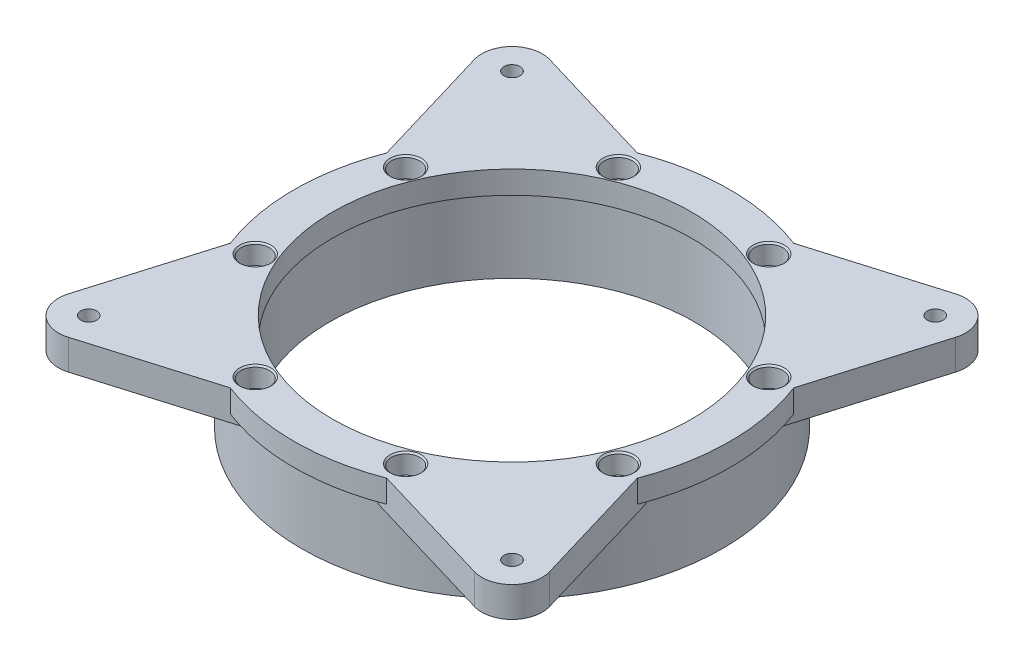
from build123d import *

# Parameters (mm, degrees)
SKETCH2_R                                     = 88.395010725
SKETCH2_R_2                                   = 76.6365
BOSS_EXTRUDE1_DEPTH                           = 40.64
BOSS_EXTRUDE2_START                           = -12.7
BOSS_EXTRUDE2_DEPTH                           = 12.7
CBORE_FOR_1_4_SOCKET_HEAD_CAP_SCREW1_AT_COUNT = 2
CBORE_FOR_1_4_SOCKET_HEAD_CAP_SCREW1_AT_PITCH = 177.8
CBORE_FOR_1_4_SOCKET_HEAD_CAP_SCREW1_2_COUNT  = 2
CBORE_FOR_1_4_SOCKET_HEAD_CAP_SCREW1_2_PITCH  = 251.44717139
CBORE_FOR_1_4_SOCKET_HEAD_CAP_SCREW1_3_COUNT  = 2
CBORE_FOR_1_4_SOCKET_HEAD_CAP_SCREW1_3_PITCH  = 177.8
SKETCH10_R                                    = 91.570010725
SKETCH10_R_2                                  = 75.3865
BOSS_EXTRUDE3_DEPTH                           = 9.525
CBORE_FOR_1_4_BUTTON_HEAD_CAP_SCREW1_AT_COUNT = 2
CBORE_FOR_1_4_BUTTON_HEAD_CAP_SCREW1_AT_PITCH = 63.181034683
CBORE_FOR_1_4_BUTTON_HEAD_CAP_SCREW1_2_COUNT  = 2
CBORE_FOR_1_4_BUTTON_HEAD_CAP_SCREW1_2_PITCH  = 116.743329574
CBORE_FOR_1_4_BUTTON_HEAD_CAP_SCREW1_3_COUNT  = 2
CBORE_FOR_1_4_BUTTON_HEAD_CAP_SCREW1_3_PITCH  = 152.532510818
CBORE_FOR_1_4_BUTTON_HEAD_CAP_SCREW1_4_COUNT  = 2
CBORE_FOR_1_4_BUTTON_HEAD_CAP_SCREW1_4_PITCH  = 165.1
CBORE_FOR_1_4_BUTTON_HEAD_CAP_SCREW1_5_COUNT  = 2
CBORE_FOR_1_4_BUTTON_HEAD_CAP_SCREW1_5_PITCH  = 152.532510818
CBORE_FOR_1_4_BUTTON_HEAD_CAP_SCREW1_6_COUNT  = 2
CBORE_FOR_1_4_BUTTON_HEAD_CAP_SCREW1_6_PITCH  = 116.743329574
CBORE_FOR_1_4_BUTTON_HEAD_CAP_SCREW1_7_COUNT  = 2
CBORE_FOR_1_4_BUTTON_HEAD_CAP_SCREW1_7_PITCH  = 63.181034683


with BuildPart() as part:
    # Sketch2 → Boss-Extrude1 (new body)
    with BuildSketch(Plane(origin=(0, 0, 0), x_dir=(1, 0, 0), z_dir=(0, 1, 0))):
        with Locations(Location((112.864370177, 65.400443246, 0), (0, 0, 270))):
            Circle(SKETCH2_R)
        with Locations(Location((112.864370177, 65.400443246, 0), (0, 0, 270))):
            Circle(SKETCH2_R_2, mode=Mode.SUBTRACT)
    extrude(amount=BOSS_EXTRUDE1_DEPTH)

    # Sketch7 → Boss-Extrude2 (add)
    with BuildSketch(Plane(origin=(0, 40.64, 0), x_dir=(1, 0, 0), z_dir=(0, 1, 0)).offset(BOSS_EXTRUDE2_START)):
        with BuildLine():
            Line((27.586360499, 166.473001979), (85.159974048, 149.341758199))
            ThreePointArc((85.159974048, 149.341758199), (50.359658671, 127.905154752), (28.923055224, 93.104839375))
            Line((28.923055224, 93.104839375), (11.791811444, 150.678452924))
            ThreePointArc((11.791811444, 150.678452924), (14.984114056, 163.280699367), (27.586360499, 166.473001979))
        make_face()
        with BuildLine():
            Line((198.142379855, 166.473001979), (140.568766306, 149.341758199))
            ThreePointArc((140.568766306, 149.341758199), (175.369081684, 127.905154752), (196.805685131, 93.104839375))
            Line((196.805685131, 93.104839375), (213.93692891, 150.678452924))
            ThreePointArc((213.93692891, 150.678452924), (210.744626298, 163.280699367), (198.142379855, 166.473001979))
        make_face()
        with BuildLine():
            Line((213.93692891, -19.877566432), (196.805685131, 37.696047117))
            ThreePointArc((196.805685131, 37.696047117), (175.369081684, 2.89573174), (140.568766306, -18.540871708))
            Line((140.568766306, -18.540871708), (198.142379855, -35.672115487))
            ThreePointArc((198.142379855, -35.672115487), (210.744626298, -32.479812875), (213.93692891, -19.877566432))
        make_face()
        with BuildLine():
            Line((27.586360499, -35.672115487), (85.159974048, -18.540871708))
            ThreePointArc((85.159974048, -18.540871708), (50.359658671, 2.89573174), (28.923055224, 37.696047117))
            Line((28.923055224, 37.696047117), (11.791811444, -19.877566432))
            ThreePointArc((11.791811444, -19.877566432), (14.984114056, -32.479812875), (27.586360499, -35.672115487))
        make_face()
    extrude(amount=BOSS_EXTRUDE2_DEPTH)

    # Sketch9 → CBORE for 1/4 Socket Head Cap Screw1 (revolve, cut)
    with BuildSketch(Plane(origin=(23.964370177, 27.94, 23.499556754), x_dir=(0, 0, -1), z_dir=(1, 0, 0))):
        Polygon((0, 0), (0, 12.7), (3.3782, 12.7), (3.3782, 6.35), (5.55625, 6.35), (5.55625, 0.635), (6.19125, 0), align=None)
    cbore_for_1_4_socket_head_cap_screw1 = revolve(axis=Axis((23.964370177, 21.59, 23.499556754), (0, 1, 0)), mode=Mode.SUBTRACT)

    # CBORE for 1/4 Socket Head Cap Screw1 at: CBORE for 1/4 Socket Head Cap Screw1 ×2
    with Locations(*[(i * CBORE_FOR_1_4_SOCKET_HEAD_CAP_SCREW1_AT_PITCH, 0, 0) for i in range(1, CBORE_FOR_1_4_SOCKET_HEAD_CAP_SCREW1_AT_COUNT)]):
        add(cbore_for_1_4_socket_head_cap_screw1, mode=Mode.SUBTRACT)

    # CBORE for 1_4 Socket Head Cap Screw1 2: CBORE for 1/4 Socket Head Cap Screw1 ×2
    with Locations(*[Vector(0.7071067811865512, 0, -0.7071067811865438) * (i * CBORE_FOR_1_4_SOCKET_HEAD_CAP_SCREW1_2_PITCH) for i in range(1, CBORE_FOR_1_4_SOCKET_HEAD_CAP_SCREW1_2_COUNT)]):
        add(cbore_for_1_4_socket_head_cap_screw1, mode=Mode.SUBTRACT)

    # CBORE for 1_4 Socket Head Cap Screw1 3: CBORE for 1/4 Socket Head Cap Screw1 ×2
    with Locations(*[(0, 0, -i * CBORE_FOR_1_4_SOCKET_HEAD_CAP_SCREW1_3_PITCH) for i in range(1, CBORE_FOR_1_4_SOCKET_HEAD_CAP_SCREW1_3_COUNT)]):
        add(cbore_for_1_4_socket_head_cap_screw1, mode=Mode.SUBTRACT)

    # Sketch10 → Boss-Extrude3 (add)
    with BuildSketch(Plane(origin=(0, 40.64, 0), x_dir=(1, 0, 0), z_dir=(0, 1, 0))):
        with Locations((112.864370177, 65.400443246)):
            Circle(SKETCH10_R)
        with Locations(Location((112.864370177, 65.400443246, 0), (0, 0, 270))):
            Circle(SKETCH10_R_2, mode=Mode.SUBTRACT)
    extrude(amount=-BOSS_EXTRUDE3_DEPTH)

    # Sketch12 → CBORE for 1/4 Button Head Cap Screw1 (revolve, cut)
    with BuildSketch(Plane(origin=(36.598114768, 40.64, -33.809925904), x_dir=(0, 0, 1), z_dir=(1, 0, 0))):
        Polygon((0, 0), (0, 40.64), (3.3782, 40.64), (3.3782, 8.35279), (5.95376, 8.35279), (5.95376, 0.635), (6.58876, 0), align=None)
    cbore_for_1_4_button_head_cap_screw1 = revolve(axis=Axis((36.598114768, 46.99, -33.809925904), (0, -1, 0)), mode=Mode.SUBTRACT)

    # CBORE for 1/4 Button Head Cap Screw1 at: CBORE for 1/4 Button Head Cap Screw1 ×2
    with Locations(*[(0, 0, -i * CBORE_FOR_1_4_BUTTON_HEAD_CAP_SCREW1_AT_PITCH) for i in range(1, CBORE_FOR_1_4_BUTTON_HEAD_CAP_SCREW1_AT_COUNT)]):
        add(cbore_for_1_4_button_head_cap_screw1, mode=Mode.SUBTRACT)

    # CBORE for 1_4 Button Head Cap Screw1 2: CBORE for 1/4 Button Head Cap Screw1 ×2
    with Locations(*[Vector(0.3826834323650937, 0, -0.9238795325112852) * (i * CBORE_FOR_1_4_BUTTON_HEAD_CAP_SCREW1_2_PITCH) for i in range(1, CBORE_FOR_1_4_BUTTON_HEAD_CAP_SCREW1_2_COUNT)]):
        add(cbore_for_1_4_button_head_cap_screw1, mode=Mode.SUBTRACT)

    # CBORE for 1_4 Button Head Cap Screw1 3: CBORE for 1/4 Button Head Cap Screw1 ×2
    with Locations(*[Vector(0.7071067811865462, 0, -0.7071067811865489) * (i * CBORE_FOR_1_4_BUTTON_HEAD_CAP_SCREW1_3_PITCH) for i in range(1, CBORE_FOR_1_4_BUTTON_HEAD_CAP_SCREW1_3_COUNT)]):
        add(cbore_for_1_4_button_head_cap_screw1, mode=Mode.SUBTRACT)

    # CBORE for 1_4 Button Head Cap Screw1 4: CBORE for 1/4 Button Head Cap Screw1 ×2
    with Locations(*[Vector(0.9238795325112864, 0, -0.38268343236509067) * (i * CBORE_FOR_1_4_BUTTON_HEAD_CAP_SCREW1_4_PITCH) for i in range(1, CBORE_FOR_1_4_BUTTON_HEAD_CAP_SCREW1_4_COUNT)]):
        add(cbore_for_1_4_button_head_cap_screw1, mode=Mode.SUBTRACT)

    # CBORE for 1_4 Button Head Cap Screw1 5: CBORE for 1/4 Button Head Cap Screw1 ×2
    with Locations(*[(i * CBORE_FOR_1_4_BUTTON_HEAD_CAP_SCREW1_5_PITCH, 0, 0) for i in range(1, CBORE_FOR_1_4_BUTTON_HEAD_CAP_SCREW1_5_COUNT)]):
        add(cbore_for_1_4_button_head_cap_screw1, mode=Mode.SUBTRACT)

    # CBORE for 1_4 Button Head Cap Screw1 6: CBORE for 1/4 Button Head Cap Screw1 ×2
    with Locations(*[Vector(0.9238795325112864, 0, 0.3826834323650908) * (i * CBORE_FOR_1_4_BUTTON_HEAD_CAP_SCREW1_6_PITCH) for i in range(1, CBORE_FOR_1_4_BUTTON_HEAD_CAP_SCREW1_6_COUNT)]):
        add(cbore_for_1_4_button_head_cap_screw1, mode=Mode.SUBTRACT)

    # CBORE for 1_4 Button Head Cap Screw1 7: CBORE for 1/4 Button Head Cap Screw1 ×2
    with Locations(*[Vector(0.7071067811865459, 0, 0.7071067811865491) * (i * CBORE_FOR_1_4_BUTTON_HEAD_CAP_SCREW1_7_PITCH) for i in range(1, CBORE_FOR_1_4_BUTTON_HEAD_CAP_SCREW1_7_COUNT)]):
        add(cbore_for_1_4_button_head_cap_screw1, mode=Mode.SUBTRACT)


solid = part.part
